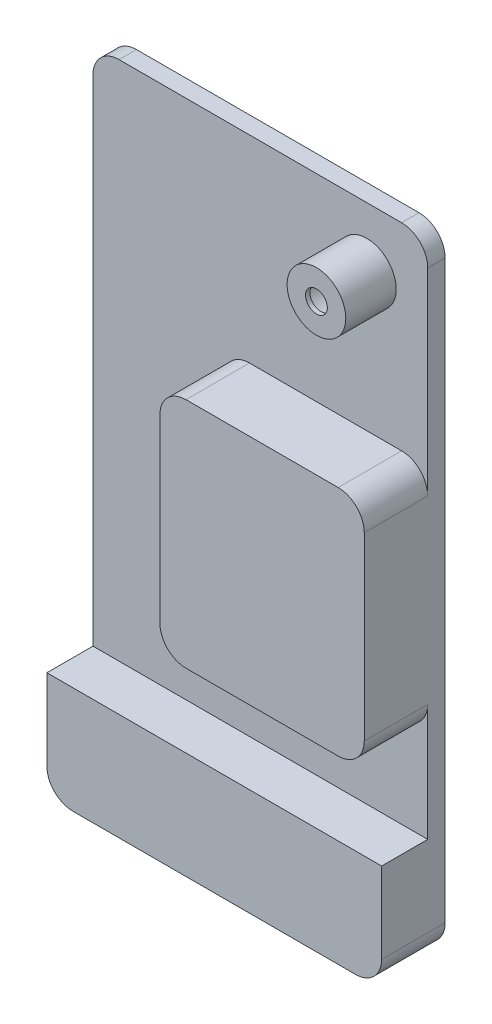
from build123d import *

# Parameters (mm, degrees)
SKIZZE2_W                       = 144.44
SKIZZE2_H                       = 77
AUFSATZ_LINEAR_AUSTRAGEN1_DEPTH = 4
SKIZZE4_W                       = 77
SKIZZE4_H                       = 24.6
AUFSATZ_LINEAR_AUSTRAGEN2_DEPTH = 10.6
VERRUNDUNG2_R                   = 6
SKIZZE5_W                       = 47
SKIZZE5_H                       = 53.5
AUFSATZ_LINEAR_AUSTRAGEN3_DEPTH = 14.6
VERRUNDUNG4_R                   = 6
SKIZZE7_R                       = 6.75
AUFSATZ_LINEAR_AUSTRAGEN5_DEPTH = 11.6
WANDUNG2_T                      = -1
SKIZZE8_R                       = 2.5
SCHNITT_LINEAR_AUSTRAGEN1_DEPTH = 84.314694982


with BuildPart() as part:
    # Skizze2 → Aufsatz-Linear austragen1 (new body)
    with BuildSketch(Plane(origin=(0, 0, 0), x_dir=(0, 1, 0), z_dir=(0, 0, 1))):
        Rectangle(SKIZZE2_W, SKIZZE2_H)
    extrude(amount=AUFSATZ_LINEAR_AUSTRAGEN1_DEPTH)

    # Skizze4 → Aufsatz-Linear austragen2 (add)
    with BuildSketch(Plane.XY.offset(4)):
        with Locations((0, -59.92)):
            Rectangle(SKIZZE4_W, SKIZZE4_H)
    extrude(amount=AUFSATZ_LINEAR_AUSTRAGEN2_DEPTH)

    # Verrundung2
    verrundung2_edges = [part.edges().sort_by_distance(p)[0] for p in [
        (38.5, 72.22, 2),
        (38.5, -72.22, 7.3),
        (-38.5, -72.22, 7.3),
        (-38.5, 72.22, 2),
    ]]
    fillet(verrundung2_edges, radius=VERRUNDUNG2_R)

    # Skizze5 → Aufsatz-Linear austragen3 (add)
    with BuildSketch(Plane.XY.offset(4)):
        with Locations((15, 0.03)):
            Rectangle(SKIZZE5_W, SKIZZE5_H)
    extrude(amount=AUFSATZ_LINEAR_AUSTRAGEN3_DEPTH)

    # Verrundung4
    verrundung4_edges = [part.edges().sort_by_distance(p)[0] for p in [
        (38.5, -26.72, 11.3),
        (38.5, 26.78, 11.3),
        (-8.5, 26.78, 11.3),
        (-8.5, -26.72, 11.3),
    ]]
    fillet(verrundung4_edges, radius=VERRUNDUNG4_R)

    # Skizze7 → Aufsatz-Linear austragen5 (add)
    with BuildSketch(Plane.XY.offset(4)):
        with Locations(Location((24.503110224, 58.349132978, 0), (0, 0, 180))):
            Circle(SKIZZE7_R)
    extrude(amount=AUFSATZ_LINEAR_AUSTRAGEN5_DEPTH)

    # Wandung2
    wandung2_openings = [part.faces().sort_by_distance(p)[0] for p in [
        (0, 0, 0),
    ]]
    offset(amount=WANDUNG2_T, openings=wandung2_openings, kind=Kind.INTERSECTION)

    # Skizze8 → Schnitt-Linear austragen1 (cut, through all)
    with BuildSketch(Plane.XY.offset(15.6)):
        with Locations((24.503110224, 58.349132978)):
            Circle(SKIZZE8_R)
    extrude(amount=-SCHNITT_LINEAR_AUSTRAGEN1_DEPTH, mode=Mode.SUBTRACT)


solid = part.part
